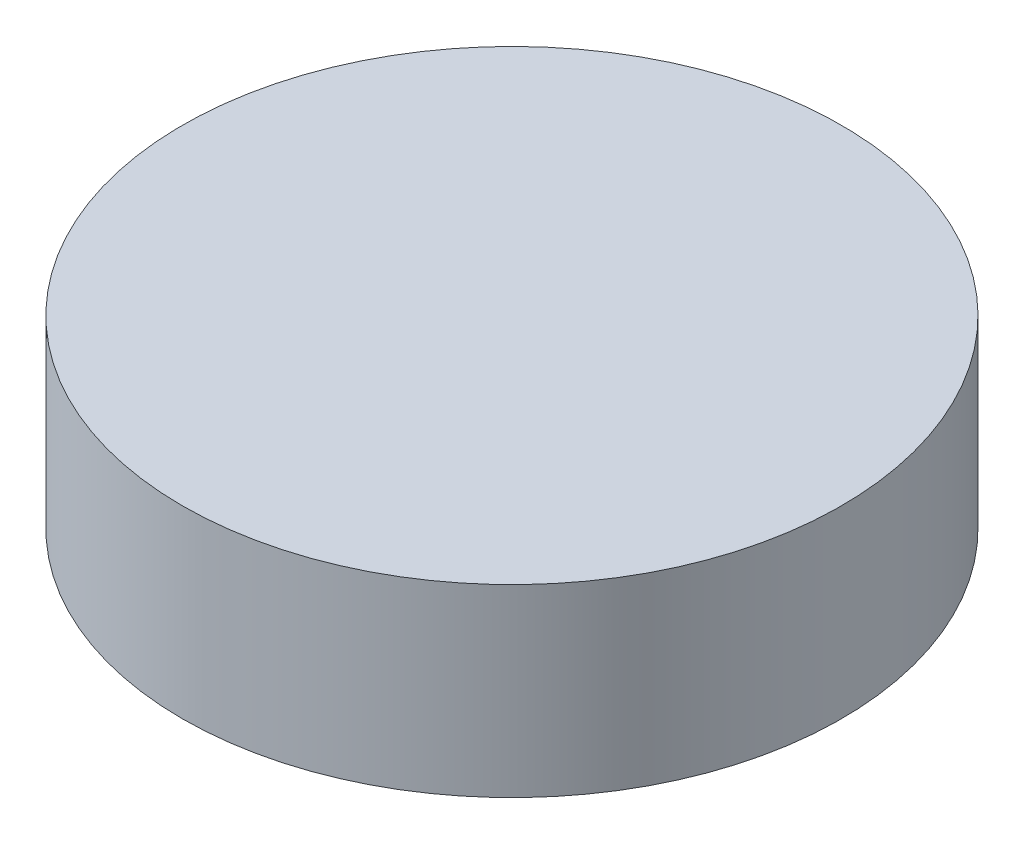
from build123d import *

# Parameters (mm, degrees)
SKETCH1_R           = 1.59
BOSS_EXTRUDE1_DEPTH = 0.89


with BuildPart() as part:
    # Sketch1 → Boss-Extrude1 (new body)
    with BuildSketch(Plane(origin=(0, 0, 0), x_dir=(1, 0, 0), z_dir=(0, 1, 0))):
        with Locations(Location((0, 0, 0), (0, 0, 270))):
            Circle(SKETCH1_R)
    extrude(amount=BOSS_EXTRUDE1_DEPTH)


solid = part.part
